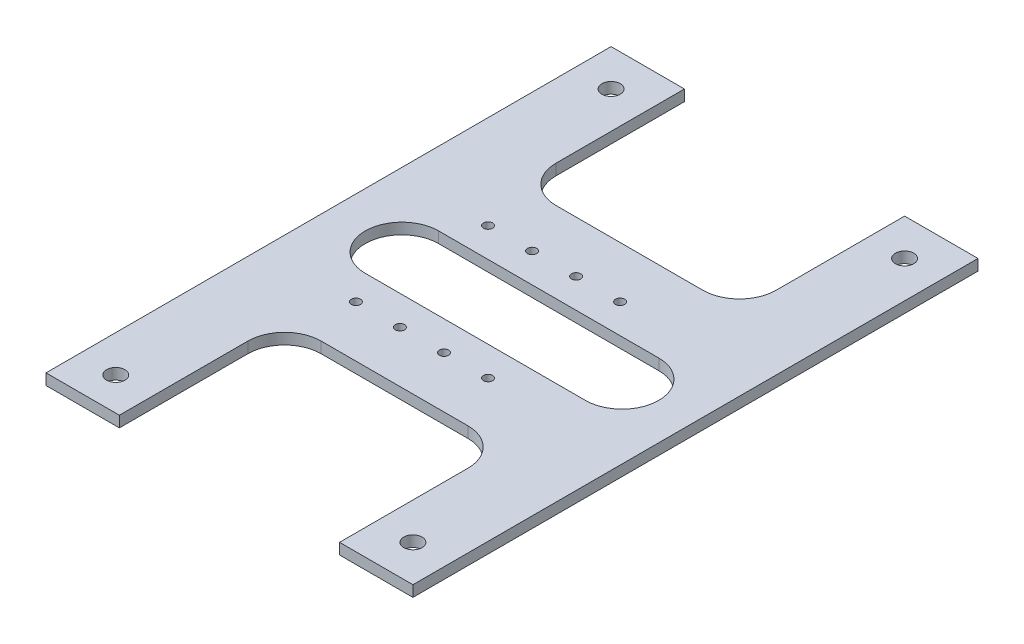
from build123d import *

# Parameters (mm, degrees)
SKETCH_1_W          = 100
SKETCH_1_H          = 154
SKETCH_1_R          = 2.5
EXTRUDE_1_DEPTH     = 3
SKETCH_4_R          = 1.25
CUT_EXTRUDE_1_DEPTH = 3
CUT_EXTRUDE_2_DEPTH = 10
CUT_EXTRUDE_3_DEPTH = 10


with BuildPart() as part:
    # 스케치1 → 보스-돌출1 (new body)
    with BuildSketch(Plane(origin=(0, -15.691888839, 0), x_dir=(1, 0, 0), z_dir=(0, 1, 0))):
        with Locations((994.328, -155.973817188)):
            Rectangle(SKETCH_1_W, SKETCH_1_H)
        with Locations(Location((1034.328, -88.973817188, 0), (0, 0, 270))):
            Circle(SKETCH_1_R, mode=Mode.SUBTRACT)
        with Locations(Location((1034.328, -222.973817188, 0), (0, 0, 270))):
            Circle(SKETCH_1_R, mode=Mode.SUBTRACT)
        with Locations(Location((954.328, -223.956502664, 0), (0, 0, 270))):
            Circle(SKETCH_1_R, mode=Mode.SUBTRACT)
        with Locations(Location((954.328, -88.973817188, 0), (0, 0, 270))):
            Circle(SKETCH_1_R, mode=Mode.SUBTRACT)
    extrude(amount=EXTRUDE_1_DEPTH)

    # 스케치4 → 컷-돌출1 (cut)
    with BuildSketch(Plane(origin=(0, -12.691888839, 0), x_dir=(1, 0, 0), z_dir=(0, 1, 0))):
        with Locations(Location((969.801034838, -137.973817188, 0), (0, 0, 270))):
            Circle(SKETCH_4_R)
        with Locations(Location((1005.801034838, -137.973817188, 0), (0, 0, 270))):
            Circle(SKETCH_4_R)
        with Locations(Location((1005.801034838, -173.973817188, 0), (0, 0, 270))):
            Circle(SKETCH_4_R)
        with Locations(Location((969.801034838, -173.973817188, 0), (0, 0, 270))):
            Circle(SKETCH_4_R)
        with Locations(Location((993.801034838, -137.973817188, 0), (0, 0, 270))):
            Circle(SKETCH_4_R)
        with Locations(Location((981.801034838, -137.973817188, 0), (0, 0, 270))):
            Circle(SKETCH_4_R)
        with Locations(Location((981.801034838, -173.973817188, 0), (0, 0, 270))):
            Circle(SKETCH_4_R)
        with Locations(Location((993.801034838, -173.973817188, 0), (0, 0, 270))):
            Circle(SKETCH_4_R)
    extrude(amount=-CUT_EXTRUDE_1_DEPTH, mode=Mode.SUBTRACT)

    # 스케치5 → 컷-돌출2 (cut)
    with BuildSketch(Plane(origin=(0, -12.691888839, 0), x_dir=(1, 0, 0), z_dir=(0, 1, 0))):
        with BuildLine():
            Line((964.328, -78.875628165), (1024.328, -78.875628165))
            Line((1024.328, -78.875628165), (1024.328, -113.973817188))
            ThreePointArc((1024.328, -113.973817188), (1021.399067812, -121.044884999), (1014.328, -123.973817188))
            Line((1014.328, -123.973817188), (974.328, -123.973817188))
            ThreePointArc((974.328, -123.973817188), (967.256932188, -121.044884999), (964.328, -113.973817188))
            Line((964.328, -113.973817188), (964.328, -78.875628165))
        make_face()
        with BuildLine():
            Line((964.328, -238.398898185), (1024.328, -238.398898185))
            Line((1024.328, -238.398898185), (1024.328, -197.973817188))
            ThreePointArc((1024.328, -197.973817188), (1021.399067812, -190.902749376), (1014.328, -187.973817188))
            Line((1014.328, -187.973817188), (974.328, -187.973817188))
            ThreePointArc((974.328, -187.973817188), (967.256932188, -190.902749376), (964.328, -197.973817188))
            Line((964.328, -197.973817188), (964.328, -238.398898185))
        make_face()
    extrude(amount=-CUT_EXTRUDE_2_DEPTH, mode=Mode.SUBTRACT)

    # 스케치6 → 컷-돌출3 (cut)
    with BuildSketch(Plane(origin=(0, -12.691888839, 0), x_dir=(1, 0, 0), z_dir=(0, 1, 0))):
        with BuildLine():
            Line((964.328, -145.973817188), (1024.328, -145.973817188))
            ThreePointArc((1024.328, -145.973817188), (1034.328, -155.973817188), (1024.328, -165.973817188))
            Line((1024.328, -165.973817188), (964.328, -165.973817188))
            ThreePointArc((964.328, -165.973817188), (954.328, -155.973817188), (964.328, -145.973817188))
        make_face()
    extrude(amount=-CUT_EXTRUDE_3_DEPTH, mode=Mode.SUBTRACT)


solid = part.part
